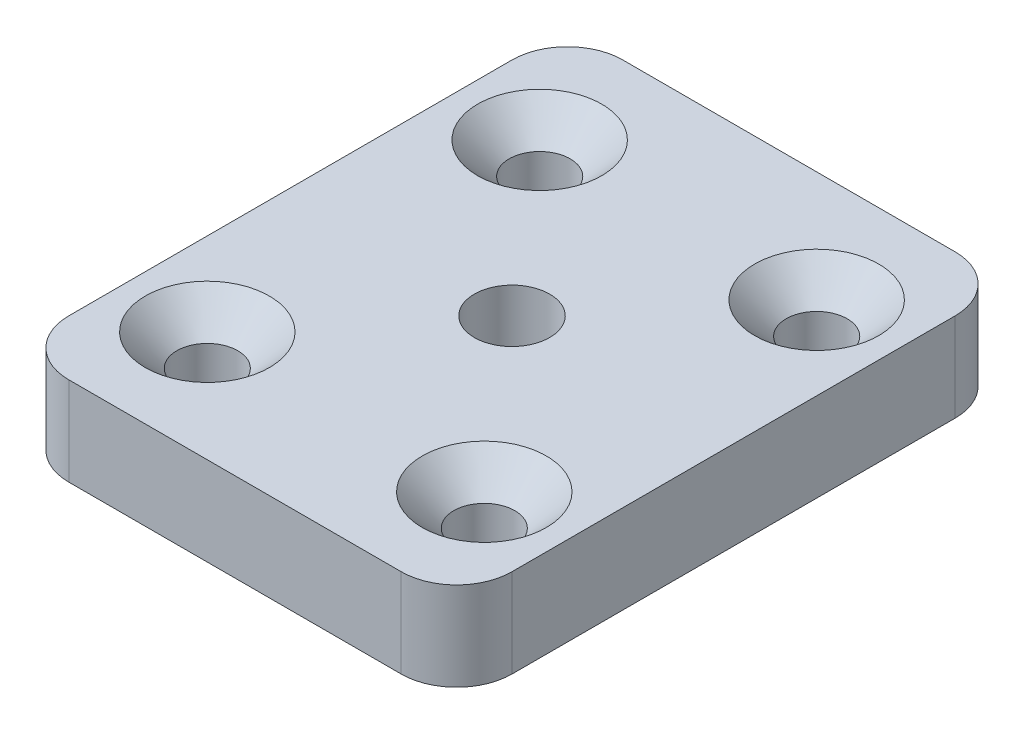
from build123d import *

# Parameters (mm, degrees)
SKETCH1_W                                            = 40
SKETCH1_H                                            = 50
BOSS_EXTRUDE1_DEPTH                                  = 8
CSK_FOR_M5_HEX_SOCKET_COUNTERSUNK_CAP_SC_D           = 5.5
CSK_FOR_M5_HEX_SOCKET_COUNTERSUNK_CAP_SC_CSINK_D     = 11.2
CSK_FOR_M5_HEX_SOCKET_COUNTERSUNK_CAP_SC_CSINK_ANGLE = 90
M8_TAPPED_HOLE1_D                                    = 6.8
FILLET1_R                                            = 5


with BuildPart() as part:
    # Sketch1 → Boss-Extrude1 (new body)
    with BuildSketch(Plane(origin=(0, 0, 0), x_dir=(1, 0, 0), z_dir=(0, 1, 0))):
        Rectangle(SKETCH1_W, SKETCH1_H)
    extrude(amount=BOSS_EXTRUDE1_DEPTH)

    # CSK for M5 Hex Socket Countersunk Cap Screw1 (through all)
    with Locations(Plane(origin=(0, 8, 0), x_dir=(1, 0, 0), z_dir=(0, 1, 0))):
        with Locations((-12.5, 15), (-12.5, -15), (12.5, -15), (12.5, 15)):
            CounterSinkHole(CSK_FOR_M5_HEX_SOCKET_COUNTERSUNK_CAP_SC_D / 2, CSK_FOR_M5_HEX_SOCKET_COUNTERSUNK_CAP_SC_CSINK_D / 2, counter_sink_angle=CSK_FOR_M5_HEX_SOCKET_COUNTERSUNK_CAP_SC_CSINK_ANGLE)

    # M8 Tapped Hole1 (through all)
    with Locations(Plane(origin=(0, 8, 0), x_dir=(1, 0, 0), z_dir=(0, 1, 0))):
        with Locations((0, 0)):
            Hole(M8_TAPPED_HOLE1_D / 2)

    # Fillet1
    fillet1_edges = [part.edges().sort_by_distance(p)[0] for p in [
        (20, 4, 25),
        (-20, 4, 25),
        (-20, 4, -25),
        (20, 4, -25),
    ]]
    fillet(fillet1_edges, radius=FILLET1_R)


solid = part.part
